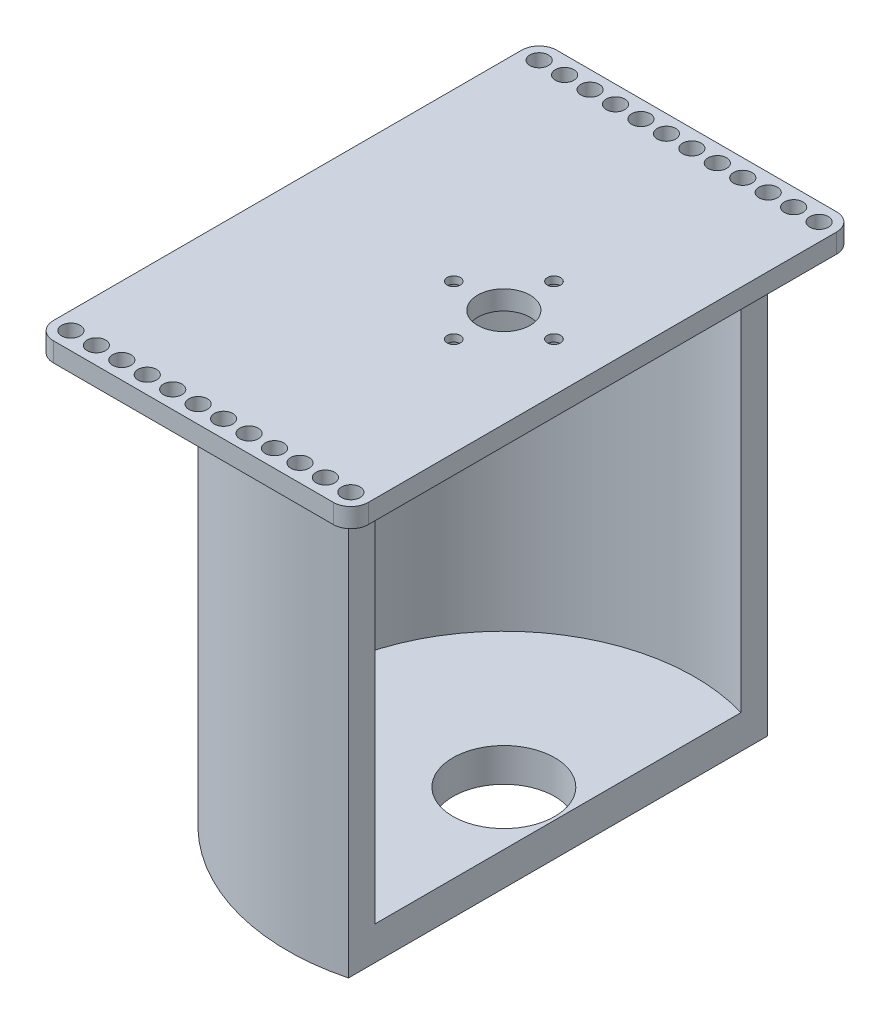
from build123d import *

# Parameters (mm, degrees)
SKETCH1_R                      = 53.975
SKETCH1_R_2                    = 12.7
BOSS_EXTRUDE1_DEPTH            = 8.382
BOSS_EXTRUDE2_DEPTH            = 98.2345
SKETCH6_R                      = 53.975
SKETCH6_R_2                    = 6.55
BOSS_EXTRUDE6_DEPTH            = 4.8
CBORE_FOR_M3_SHCS1_D           = 3.3
CBORE_FOR_M3_SHCS1_DEPTH       = 4.8
CBORE_FOR_M3_SHCS1_CBORE_D     = 6.5
CBORE_FOR_M3_SHCS1_CBORE_DEPTH = 3
CUT_EXTRUDE2_DEPTH             = 129.229128673
BOSS_EXTRUDE7_START            = -4.8
SKETCH10_R                     = 2.3114
BOSS_EXTRUDE7_DEPTH            = 4.8
SKETCH11_W                     = 29.36875
SKETCH11_H                     = 96.079822772
CUT_EXTRUDE3_DEPTH             = 139.812722053


with BuildPart() as part:
    # Sketch1 → Boss-Extrude1 (new body)
    with BuildSketch(Plane(origin=(0, 0, 0), x_dir=(1, 0, 0), z_dir=(0, 1, 0))):
        with Locations(Location((0, 0, 0), (0, 0, 270))):
            Circle(SKETCH1_R)
        with Locations(Location((0, 0, 0), (0, 0, 270))):
            Circle(SKETCH1_R_2, mode=Mode.SUBTRACT)
    extrude(amount=BOSS_EXTRUDE1_DEPTH)

    # Sketch3 → Boss-Extrude2 (add)
    with BuildSketch(Plane(origin=(0, 8.382, 0), x_dir=(1, 0, 0), z_dir=(0, 1, 0))):
        with BuildLine():
            Line((13.49375, 45.673398559), (13.49375, 52.261069028))
            ThreePointArc((13.49375, 52.261069028), (-53.975, 0), (13.49375, -52.261069028))
            Line((13.49375, -52.261069028), (13.49375, -45.673398559))
            ThreePointArc((13.49375, -45.673398559), (-47.625, 0), (13.49375, 45.673398559))
        make_face()
    extrude(amount=BOSS_EXTRUDE2_DEPTH)

    # Sketch6 → Boss-Extrude6 (add)
    with BuildSketch(Plane(origin=(0, 106.6165, 0), x_dir=(1, 0, 0), z_dir=(0, 1, 0))):
        with Locations(Location((0, 0, 0), (0, 0, 270))):
            Circle(SKETCH6_R)
        with Locations(Location((0, 0, 0), (0, 0, 270))):
            Circle(SKETCH6_R_2, mode=Mode.SUBTRACT)
    extrude(amount=BOSS_EXTRUDE6_DEPTH)

    # CBORE for M3 SHCS1
    with Locations(Plane(origin=(0, 106.6165, 0), x_dir=(-1, 0, 0), z_dir=(0, -1, 0))):
        with Locations((-12.5, 0), (0, -12.5), (0, 12.5), (12.5, 0)):
            CounterBoreHole(CBORE_FOR_M3_SHCS1_D / 2, CBORE_FOR_M3_SHCS1_CBORE_D / 2, CBORE_FOR_M3_SHCS1_CBORE_DEPTH, depth=CBORE_FOR_M3_SHCS1_DEPTH)

    # Sketch3<3> → Cut-Extrude2 (cut, through all)
    with BuildSketch(Plane(origin=(0, 8.382, 0), x_dir=(1, 0, 0), z_dir=(0, 1, 0))):
        with BuildLine():
            ThreePointArc((13.49375, -52.261069028), (53.975, 0), (13.49375, 52.261069028))
            Line((13.49375, 52.261069028), (13.49375, 45.673398559))
            Line((13.49375, 45.673398559), (13.49375, -45.673398559))
            Line((13.49375, -45.673398559), (13.49375, -52.261069028))
        make_face()
    extrude(amount=-CUT_EXTRUDE2_DEPTH, mode=Mode.SUBTRACT)

    # Sketch10 → Boss-Extrude7 (add)
    with BuildSketch(Plane(origin=(0, 111.4165, 0), x_dir=(1, 0, 0), z_dir=(0, 1, 0)).offset(BOSS_EXTRUDE7_START)):
        with BuildLine():
            Line((-53.975, 58.42), (-53.975, 0))
            ThreePointArc((-53.975, 0), (-28.152959713, 46.051183311), (24.60625, 48.039911386))
            Line((24.60625, 48.039911386), (24.60625, 58.42))
            ThreePointArc((24.60625, 58.42), (23.327588042, 61.506963042), (20.240625, 62.785625))
            Line((20.240625, 62.785625), (-49.609375, 62.785625))
            ThreePointArc((-49.609375, 62.785625), (-52.696338042, 61.506963042), (-53.975, 58.42))
        make_face()
        with Locations(Location((-49.609375, 58.42, 0), (0, 0, 270))):
            Circle(SKETCH10_R, mode=Mode.SUBTRACT)
        with Locations(Location((-43.259375, 58.42, 0), (0, 0, 270))):
            Circle(SKETCH10_R, mode=Mode.SUBTRACT)
        with Locations(Location((-36.909375, 58.42, 0), (0, 0, 270))):
            Circle(SKETCH10_R, mode=Mode.SUBTRACT)
        with Locations(Location((-30.559375, 58.42, 0), (0, 0, 270))):
            Circle(SKETCH10_R, mode=Mode.SUBTRACT)
        with Locations(Location((-24.209375, 58.42, 0), (0, 0, 270))):
            Circle(SKETCH10_R, mode=Mode.SUBTRACT)
        with Locations(Location((-17.859375, 58.42, 0), (0, 0, 270))):
            Circle(SKETCH10_R, mode=Mode.SUBTRACT)
        with Locations(Location((-11.509375, 58.42, 0), (0, 0, 270))):
            Circle(SKETCH10_R, mode=Mode.SUBTRACT)
        with Locations(Location((-5.159375, 58.42, 0), (0, 0, 270))):
            Circle(SKETCH10_R, mode=Mode.SUBTRACT)
        with Locations(Location((1.190625, 58.42, 0), (0, 0, 270))):
            Circle(SKETCH10_R, mode=Mode.SUBTRACT)
        with Locations(Location((7.540625, 58.42, 0), (0, 0, 270))):
            Circle(SKETCH10_R, mode=Mode.SUBTRACT)
        with Locations(Location((13.890625, 58.42, 0), (0, 0, 270))):
            Circle(SKETCH10_R, mode=Mode.SUBTRACT)
        with Locations(Location((20.240625, 58.42, 0), (0, 0, 270))):
            Circle(SKETCH10_R, mode=Mode.SUBTRACT)
    boss_extrude7 = extrude(amount=BOSS_EXTRUDE7_DEPTH)

    # Mirror1: Boss-Extrude7 across plane
    add(boss_extrude7.mirror(Plane.XY))

    # Sketch11 → Cut-Extrude3 (cut, through all)
    with BuildSketch(Plane(origin=(0, 111.4165, 0), x_dir=(1, 0, 0), z_dir=(0, 1, 0))):
        with Locations((39.290625, 0)):
            Rectangle(SKETCH11_W, SKETCH11_H)
    extrude(amount=-CUT_EXTRUDE3_DEPTH, mode=Mode.SUBTRACT)


solid = part.part
